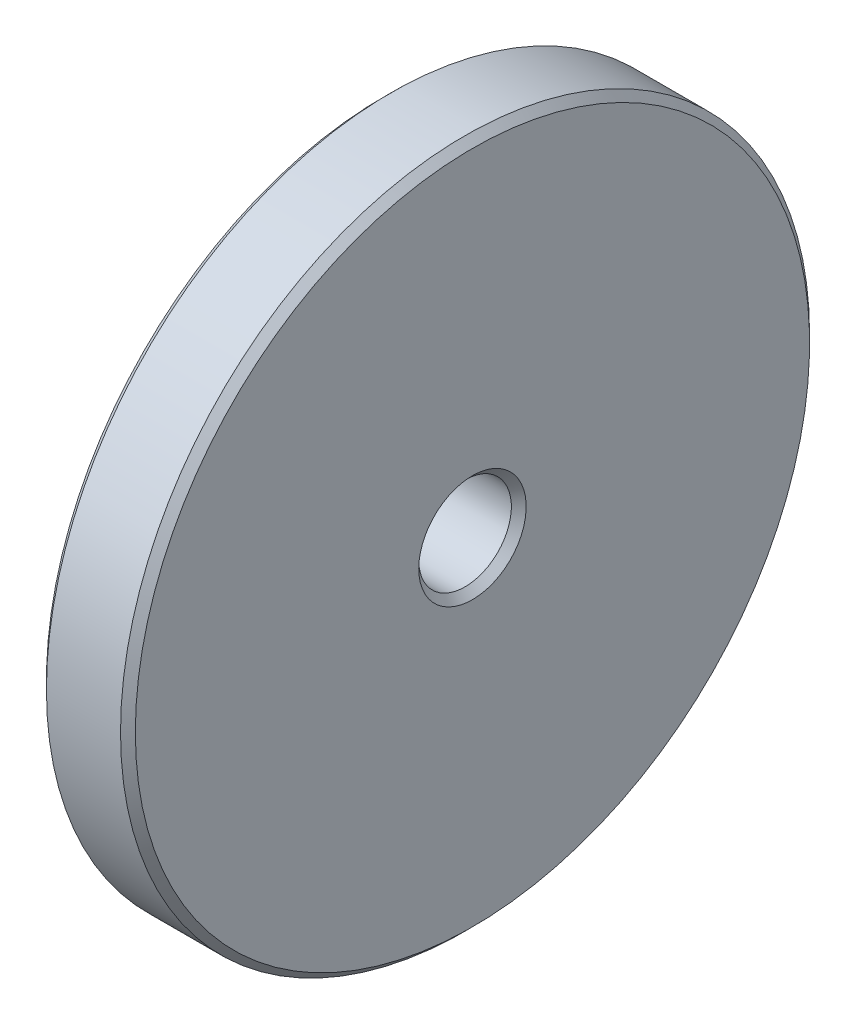
from build123d import *

# Parameters (mm, degrees)
SKETCH1_W        = 12
SKETCH1_H        = 40.25
SFAZOWANIE1_SIZE = 1


with BuildPart() as part:
    # Sketch1 → Base-Revolve (revolve)
    with BuildSketch(Plane.XY, mode=Mode.PRIVATE) as base_revolve_sk:
        with Locations((-7.238439554, 26.375)):
            Rectangle(SKETCH1_W, SKETCH1_H)
    revolve(base_revolve_sk.sketch.rotate(Axis((-17.903027245, 0, 0), (1, 0, 0)), 90), axis=Axis((-17.903027245, 0, 0), (1, 0, 0)))

    # Sfazowanie1
    sfazowanie1_edges = [part.edges().sort_by_distance(p)[0] for p in [
        (-1.238439554, 0, -6.25),
        (-1.238439554, 0, -46.5),
        (-13.238439554, 0, -46.5),
        (-13.238439554, 0, -6.25),
    ]]
    chamfer(sfazowanie1_edges, length=SFAZOWANIE1_SIZE)


solid = part.part
